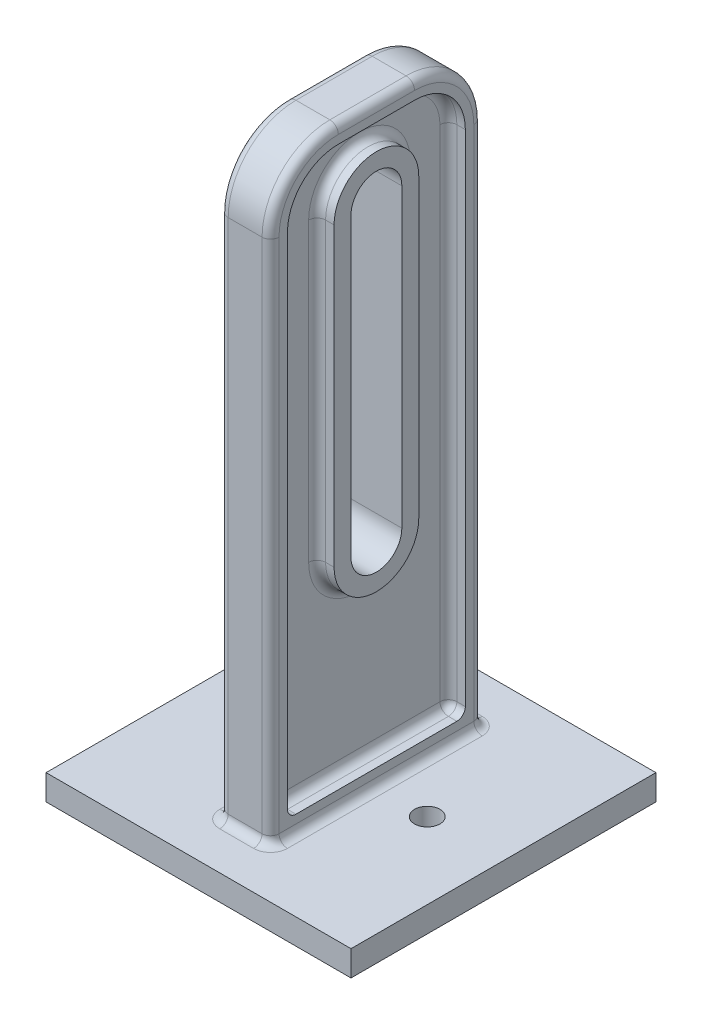
from build123d import *

# Parameters (mm, degrees)
SKETCH1_W           = 36
SKETCH1_H           = 36
BOSS_EXTRUDE1_DEPTH = 3
SKETCH2_R           = 1.5
CUT_EXTRUDE1_DEPTH  = 3
SKETCH3_W           = 6
SKETCH3_H           = 25
BOSS_EXTRUDE2_DEPTH = 70
FILLET1_R           = 8
CUT_EXTRUDE3_DEPTH  = 6
CUT_EXTRUDE4_DEPTH  = 2
FILLET2_R           = 1


with BuildPart() as part:
    # Sketch1 → Boss-Extrude1 (new body)
    with BuildSketch(Plane(origin=(0, 0, 0), x_dir=(1, 0, 0), z_dir=(0, 1, 0))):
        Rectangle(SKETCH1_W, SKETCH1_H)
    extrude(amount=BOSS_EXTRUDE1_DEPTH)

    # Sketch2 → Cut-Extrude1 (cut)
    with BuildSketch(Plane(origin=(0, 3, 0), x_dir=(1, 0, 0), z_dir=(0, 1, 0))):
        with Locations(Location((-9, 0, 0), (0, 0, 270))):
            Circle(SKETCH2_R)
        with Locations(Location((9, 0, 0), (0, 0, 270))):
            Circle(SKETCH2_R)
    extrude(amount=-CUT_EXTRUDE1_DEPTH, mode=Mode.SUBTRACT)

    # Sketch3 → Boss-Extrude2 (add)
    with BuildSketch(Plane(origin=(0, 3, 0), x_dir=(1, 0, 0), z_dir=(0, 1, 0))):
        Rectangle(SKETCH3_W, SKETCH3_H)
    extrude(amount=BOSS_EXTRUDE2_DEPTH)

    # Fillet1
    fillet1_edges = [part.edges().sort_by_distance(p)[0] for p in [
        (0, 73, -12.5),
        (0, 73, 12.5),
    ]]
    fillet(fillet1_edges, radius=FILLET1_R)

    # Sketch5 → Cut-Extrude3 (cut)
    with BuildSketch(Plane(origin=(3, 0, 0), x_dir=(0, 0, -1), z_dir=(1, 0, 0))):
        with BuildLine():
            Line((3, 63), (3, 28))
            ThreePointArc((3, 28), (0, 25), (-3, 28))
            Line((-3, 28), (-3, 63))
            ThreePointArc((-3, 63), (0, 66), (3, 63))
        make_face()
    extrude(amount=-CUT_EXTRUDE3_DEPTH, mode=Mode.SUBTRACT)

    # Sketch6 → Cut-Extrude4 (cut)
    with BuildSketch(Plane(origin=(3, 0, 0), x_dir=(0, 0, -1), z_dir=(1, 0, 0))):
        with BuildLine():
            Line((10.5, 5), (10.5, 65))
            ThreePointArc((10.5, 65), (8.742640687, 69.242640687), (4.5, 71))
            Line((4.5, 71), (-4.5, 71))
            ThreePointArc((-4.5, 71), (-8.742640687, 69.242640687), (-10.5, 65))
            Line((-10.5, 65), (-10.5, 5))
            Line((-10.5, 5), (10.5, 5))
        make_face()
        with BuildLine():
            Line((5, 28), (5, 63))
            ThreePointArc((5, 63), (0, 68), (-5, 63))
            Line((-5, 63), (-5, 28))
            ThreePointArc((-5, 28), (0, 23), (5, 28))
        make_face(mode=Mode.SUBTRACT)
    cut_extrude4 = extrude(amount=-CUT_EXTRUDE4_DEPTH, mode=Mode.SUBTRACT)

    # Mirror1: Cut-Extrude4 across plane
    add(cut_extrude4.mirror(Plane(origin=(0, 0, 0), x_dir=(0, 0, 1), z_dir=(1, 0, 0))), mode=Mode.SUBTRACT)

    # Fillet2
    fillet2_edges = [part.edges().sort_by_distance(p)[0] for p in [
        (-2, 5, -10.5),
        (-1, 23, 0),
        (-1, 45.5, -5),
        (-1, 68, 0),
        (-1, 45.5, 5),
        (3, 3, 0),
        (0, 3, -12.5),
        (-3, 3, 0),
        (0, 3, 12.5),
        (3, 73, 0),
        (-3, 73, 0),
        (-3, 34, 12.5),
        (-3, 34, -12.5),
        (-3, 70.656854249, 10.156854249),
        (-3, 70.656854249, -10.156854249),
        (3, 34, -12.5),
        (3, 34, 12.5),
        (3, 70.656854249, 10.156854249),
        (3, 70.656854249, -10.156854249),
        (1, 5, 0),
        (2, 5, -10.5),
        (1, 35, 10.5),
        (2, 5, 10.5),
        (1, 69.242640687, 8.742640687),
        (1, 71, 0),
        (1, 69.242640687, -8.742640687),
        (1, 35, -10.5),
        (1, 45.5, 5),
        (1, 23, 0),
        (1, 45.5, -5),
        (1, 68, 0),
        (-1, 5, 0),
        (-1, 35, -10.5),
        (-1, 69.242640687, -8.742640687),
        (-1, 71, 0),
        (-1, 69.242640687, 8.742640687),
        (-1, 35, 10.5),
        (-2, 5, 10.5),
    ]]
    fillet(fillet2_edges, radius=FILLET2_R)


solid = part.part
